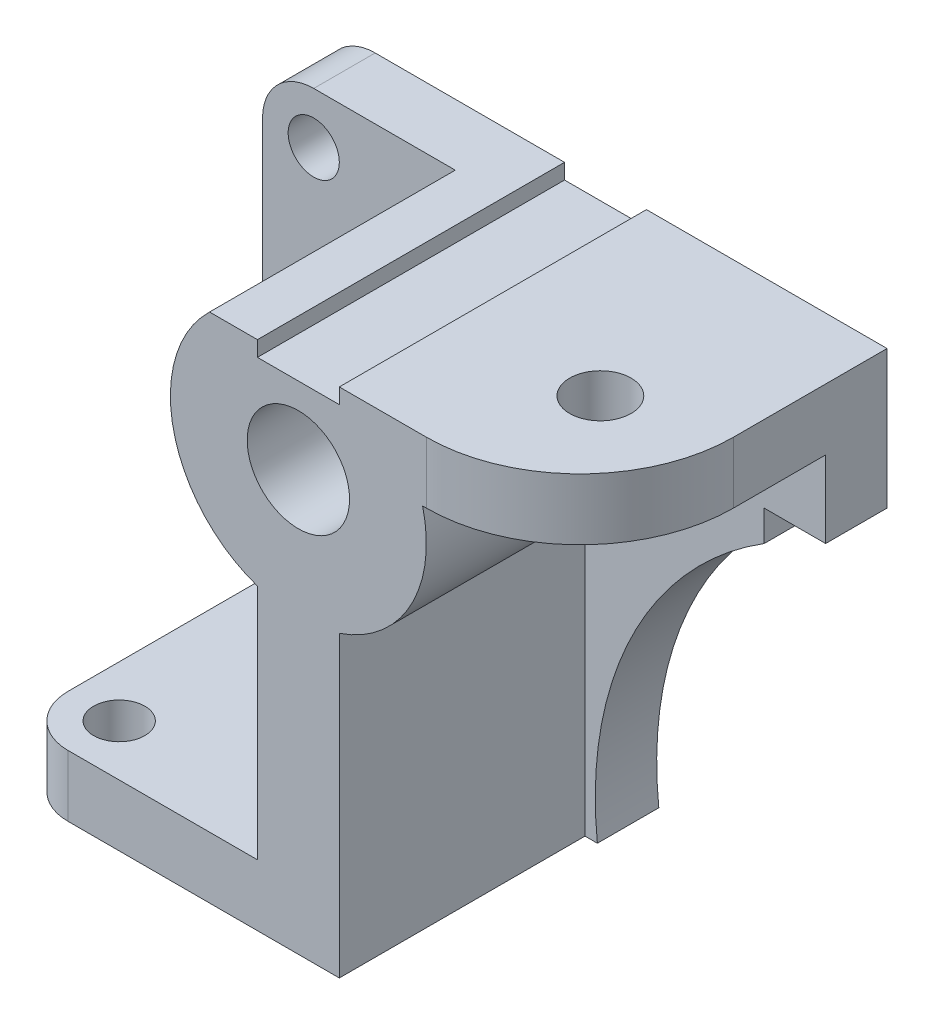
from build123d import *

# Parameters (mm, degrees)
SKETCH1_W           = 110
SKETCH1_H           = 100
BOSS_EXTRUDE1_DEPTH = 30
CUT_EXTRUDE1_DEPTH  = 48
SKETCH3_W           = 12
SKETCH3_H           = 6
CUT_EXTRUDE2_DEPTH  = 96.524865873
CUT_EXTRUDE5_DEPTH  = 48
CUT_EXTRUDE6_DEPTH  = 96.524865873
HOLE1_D             = 20
FILLET1_R           = 10
FILLET2_R           = 30
HOLE2_D             = 12
HOLE3_D             = 10
HOLE4_D             = 10
SKETCH15_W          = 16
SKETCH15_H          = 3
CUT_EXTRUDE7_DEPTH  = 96.524865873


with BuildPart() as part:
    # Sketch1 → Boss-Extrude1 (new, symmetric)
    with BuildSketch(Plane.XY):
        Rectangle(SKETCH1_W, SKETCH1_H)
    extrude(amount=BOSS_EXTRUDE1_DEPTH, both=True)

    # Sketch2 → Cut-Extrude1 (cut)
    with BuildSketch(Plane.XY.offset(30)):
        with BuildLine():
            Line((-8, 8.314561435), (-8, -38))
            Line((-8, -38), (-55, -38))
            Line((-55, -38), (-55, 50))
            Line((-55, 50), (-17.349351573, 50))
            ThreePointArc((-17.349351573, 50), (-24.393981909, 26.528834985), (-8, 8.314561435))
        make_face()
    extrude(amount=-CUT_EXTRUDE1_DEPTH, mode=Mode.SUBTRACT)

    # Sketch3 → Cut-Extrude2 (cut, through all)
    with BuildSketch(Plane.XY.offset(30)):
        with Locations((49, 20)):
            Rectangle(SKETCH3_W, SKETCH3_H)
    extrude(amount=-CUT_EXTRUDE2_DEPTH, mode=Mode.SUBTRACT)

    # Sketch4 → Cut-Extrude5 (cut)
    with BuildSketch(Plane.XY.offset(30)):
        with BuildLine():
            Line((8, -50), (10.411371468, -50))
            ThreePointArc((10.411371468, -50), (17.051338909, -11.804150412), (43, 17))
            Line((43, 17), (43, 23))
            Line((43, 23), (55, 23))
            Line((55, 23), (55, 38))
            Line((55, 38), (24.269322199, 38))
            ThreePointArc((24.269322199, 38), (21.92335751, 19.984743219), (8, 8.314561435))
            Line((8, 8.314561435), (8, -50))
        make_face()
    extrude(amount=-CUT_EXTRUDE5_DEPTH, mode=Mode.SUBTRACT)

    # Sketch6 → Cut-Extrude6 (cut, through all)
    with BuildSketch(Plane.XY.offset(30)):
        with BuildLine():
            Line((55, -50), (55, 17))
            Line((55, 17), (43, 17))
            ThreePointArc((43, 17), (17.051338909, -11.804150412), (10.411371468, -50))
            Line((10.411371468, -50), (55, -50))
        make_face()
    extrude(amount=-CUT_EXTRUDE6_DEPTH, mode=Mode.SUBTRACT)

    # Hole1 (through all)
    with Locations(Plane.XY.offset(30)):
        with Locations((0, 32)):
            Hole(HOLE1_D / 2)

    # Fillet1
    fillet1_edges = [part.edges().sort_by_distance(p)[0] for p in [
        (-55, -44, 30),
        (-55, 50, -24),
    ]]
    fillet(fillet1_edges, radius=FILLET1_R)

    # Fillet2
    fillet2_edges = [part.edges().sort_by_distance(p)[0] for p in [
        (55, 44, 30),
    ]]
    fillet(fillet2_edges, radius=FILLET2_R)

    # Hole2 (through all)
    with Locations(Plane(origin=(0, 50, 0), x_dir=(1, 0, 0), z_dir=(0, 1, 0))):
        with Locations((35, -6)):
            Hole(HOLE2_D / 2)

    # Hole3 (through all)
    with Locations(Plane(origin=(0, -38, 0), x_dir=(1, 0, 0), z_dir=(0, 1, 0))):
        with Locations((-45, -20)):
            Hole(HOLE3_D / 2)

    # Hole4 (through all)
    with Locations(Plane.XY.offset(-18)):
        with Locations((-45, 40)):
            Hole(HOLE4_D / 2)

    # Sketch15 → Cut-Extrude7 (cut, through all)
    with BuildSketch(Plane.XY.offset(30)):
        with Locations((0, 48.5)):
            Rectangle(SKETCH15_W, SKETCH15_H)
    extrude(amount=-CUT_EXTRUDE7_DEPTH, mode=Mode.SUBTRACT)


solid = part.part
